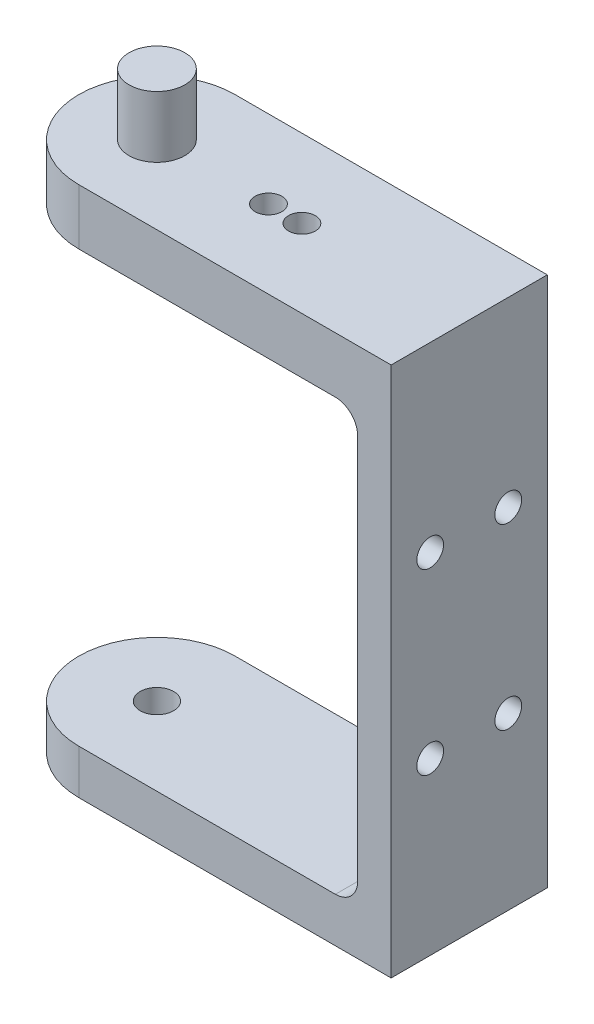
from build123d import *

# Parameters (mm, degrees)
BOSS_EXTRUDE1_DEPTH      = 5
BOSS_EXTRUDE2_DEPTH      = 4
SKETCH3_W                = 3
SKETCH3_H                = 47.6
BOSS_EXTRUDE3_DEPTH      = 7
SKETCH4_R                = 2.5
BOSS_EXTRUDE4_DEPTH      = 5.5
SKETCH5_R                = 3.7
CUT_EXTRUDE2_DEPTH       = 1.6
CUT_EXTRUDE4_DEPTH       = 1.6
SKETCH7_R                = 2.5
CUT_EXTRUDE6_DEPTH       = 1.6
SKETCH8_R                = 1.5
CUT_EXTRUDE8_DEPTH       = 4
M2_CLEARANCE_HOLE1_D     = 2.4
M2_CLEARANCE_HOLE1_DEPTH = 5
M2_CLEARANCE_HOLE1_TIP   = 0.721032743
M2_CLEARANCE_HOLE2_D     = 2.4
M2_CLEARANCE_HOLE2_DEPTH = 5
M2_CLEARANCE_HOLE2_TIP   = 0.721032743
M2_CLEARANCE_HOLE3_D     = 2.4
M2_CLEARANCE_HOLE3_DEPTH = 35
M2_CLEARANCE_HOLE4_D     = 2.4
M2_CLEARANCE_HOLE4_DEPTH = 35
M2_CLEARANCE_HOLE5_D     = 2.4
M2_CLEARANCE_HOLE5_DEPTH = 35
M2_CLEARANCE_HOLE6_D     = 2.4
M2_CLEARANCE_HOLE6_DEPTH = 35
FILLET1_R                = 2


with BuildPart() as part:
    # Sketch1 → Boss-Extrude1 (new body)
    with BuildSketch(Plane(origin=(0, 19.3, 0), x_dir=(1, 0, 0), z_dir=(0, 1, 0))):
        with BuildLine():
            Line((5.5, -7), (33.5, -7))
            Line((33.5, -7), (33.5, 7))
            Line((33.5, 7), (5.5, 7))
            ThreePointArc((5.5, 7), (-1.5, 0), (5.5, -7))
        make_face()
    extrude(amount=BOSS_EXTRUDE1_DEPTH)



with BuildPart() as body_2:
    # Sketch2 → Boss-Extrude2 (new body)
    with BuildSketch(Plane(origin=(0, -23.3, 0), x_dir=(1, 0, 0), z_dir=(0, 1, 0))):
        with BuildLine():
            Line((5.5, -7), (33.5, -7))
            Line((33.5, -7), (33.5, 7))
            Line((33.5, 7), (5.5, 7))
            ThreePointArc((5.5, 7), (-1.5, 0), (5.5, -7))
        make_face()
    extrude(amount=BOSS_EXTRUDE2_DEPTH)


with BuildPart() as part_1:
    add(part.part)

    add(body_2.part)  # Boss-Extrude3 merges body 2
    # Sketch3 → Boss-Extrude3 (add, symmetric)
    with BuildSketch(Plane.XY):
        with Locations((32, 0.5)):
            Rectangle(SKETCH3_W, SKETCH3_H)
    extrude(amount=BOSS_EXTRUDE3_DEPTH, both=True)

    # Sketch4 → Boss-Extrude4 (add)
    with BuildSketch(Plane(origin=(0, 24.3, 0), x_dir=(1, 0, 0), z_dir=(0, 1, 0))):
        with Locations(Location((5.5, 0, 0), (0, 0, 270))):
            Circle(SKETCH4_R)
    extrude(amount=BOSS_EXTRUDE4_DEPTH)

    # Sketch5 → Cut-Extrude2 (cut)
    with BuildSketch(Plane(origin=(0, 19.3, 0), x_dir=(1, 0, 0), z_dir=(0, 1, 0))):
        with Locations(Location((5.5, 0, 0), (0, 0, 270))):
            Circle(SKETCH5_R)
    extrude(amount=CUT_EXTRUDE2_DEPTH, mode=Mode.SUBTRACT)

    # Sketch6 → Cut-Extrude4 (cut)
    with BuildSketch(Plane(origin=(0, 19.3, 0), x_dir=(1, 0, 0), z_dir=(0, 1, 0))):
        with BuildLine():
            Line((5.5, -2.7), (20.7, -2.7))
            Line((20.7, -2.7), (20.7, 2.7))
            Line((20.7, 2.7), (5.5, 2.7))
            ThreePointArc((5.5, 2.7), (2.8, 0), (5.5, -2.7))
        make_face()
    extrude(amount=CUT_EXTRUDE4_DEPTH, mode=Mode.SUBTRACT)

    # Sketch7 → Cut-Extrude6 (cut)
    with BuildSketch(Plane(origin=(0, 20.9, 0), x_dir=(1, 0, 0), z_dir=(0, 1, 0))):
        with Locations(Location((5.5, 0, 0), (0, 0, 270))):
            Circle(SKETCH7_R)
    extrude(amount=CUT_EXTRUDE6_DEPTH, mode=Mode.SUBTRACT)

    # Sketch8 → Cut-Extrude8 (cut)
    with BuildSketch(Plane(origin=(0, -23.3, 0), x_dir=(1, 0, 0), z_dir=(0, 1, 0))):
        with Locations(Location((5.5, 0, 0), (0, 0, 270))):
            Circle(SKETCH8_R)
    extrude(amount=CUT_EXTRUDE8_DEPTH, mode=Mode.SUBTRACT)

    # M2 Clearance Hole1
    with Locations(Plane(origin=(0, 24.3, 0), x_dir=(1, 0, 0), z_dir=(0, 1, 0))):
        with Locations((15.5, 0)):
            Hole(M2_CLEARANCE_HOLE1_D / 2, depth=M2_CLEARANCE_HOLE1_DEPTH)
            with Locations((0, 0, -(M2_CLEARANCE_HOLE1_DEPTH + M2_CLEARANCE_HOLE1_TIP / 2))):  # 118° drill point
                Cone(0, M2_CLEARANCE_HOLE1_D / 2, M2_CLEARANCE_HOLE1_TIP, mode=Mode.SUBTRACT)

    # M2 Clearance Hole2
    with Locations(Plane(origin=(0, 24.3, 0), x_dir=(1, 0, 0), z_dir=(0, 1, 0))):
        with Locations((18.5, 0)):
            Hole(M2_CLEARANCE_HOLE2_D / 2, depth=M2_CLEARANCE_HOLE2_DEPTH)
            with Locations((0, 0, -(M2_CLEARANCE_HOLE2_DEPTH + M2_CLEARANCE_HOLE2_TIP / 2))):  # 118° drill point
                Cone(0, M2_CLEARANCE_HOLE2_D / 2, M2_CLEARANCE_HOLE2_TIP, mode=Mode.SUBTRACT)

    # M2 Clearance Hole3
    with Locations(Plane(origin=(33.5, 0, 0), x_dir=(0, 0, -1), z_dir=(1, 0, 0))):
        with Locations((3.5, -8)):
            Hole(M2_CLEARANCE_HOLE3_D / 2, depth=M2_CLEARANCE_HOLE3_DEPTH)

    # M2 Clearance Hole4
    with Locations(Plane(origin=(33.5, 0, 0), x_dir=(0, 0, -1), z_dir=(1, 0, 0))):
        with Locations((-3.5, -8)):
            Hole(M2_CLEARANCE_HOLE4_D / 2, depth=M2_CLEARANCE_HOLE4_DEPTH)

    # M2 Clearance Hole5
    with Locations(Plane(origin=(33.5, 0, 0), x_dir=(0, 0, -1), z_dir=(1, 0, 0))):
        with Locations((3.5, 8)):
            Hole(M2_CLEARANCE_HOLE5_D / 2, depth=M2_CLEARANCE_HOLE5_DEPTH)

    # M2 Clearance Hole6
    with Locations(Plane(origin=(33.5, 0, 0), x_dir=(0, 0, -1), z_dir=(1, 0, 0))):
        with Locations((-3.5, 8)):
            Hole(M2_CLEARANCE_HOLE6_D / 2, depth=M2_CLEARANCE_HOLE6_DEPTH)

    # Fillet1
    fillet1_edges = [part_1.edges().sort_by_distance(p)[0] for p in [
        (30.5, 19.3, 0),
        (30.5, -19.3, 0),
    ]]
    fillet(fillet1_edges, radius=FILLET1_R)


solid = part_1.part
